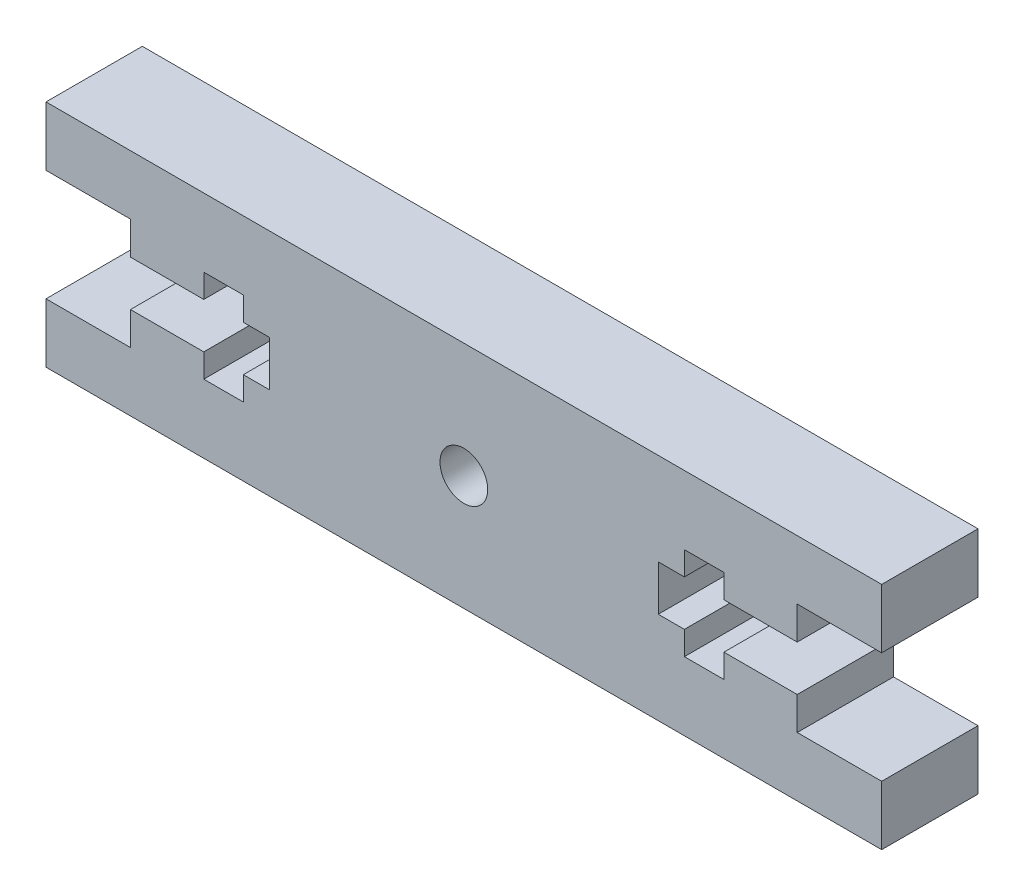
from build123d import *

# Parameters (mm, degrees)
SKETCH1_R           = 1.45
BOSS_EXTRUDE2_DEPTH = 5.85


with BuildPart() as part:
    # Sketch1 → Boss-Extrude2 (new body)
    with BuildSketch(Plane.XY):
        Polygon((728.35629315, 352.662910852), (779.11653315, 352.662910852), (779.11653315, 349.062910852), (773.98641315, 349.062910852), (773.98641315, 347.062910852), (769.53337815, 347.062910852), (769.53337815, 348.500545484), (767.132707678, 348.500545484), (767.132707678, 347.062910852), (765.545433323, 347.062910852), (765.545433323, 344.306300382), (767.132707678, 344.306300382), (767.132707678, 342.86866575), (769.53337815, 342.86866575), (769.53337815, 344.306300382), (773.98641315, 344.306300382), (773.98641315, 342.306300382), (779.11653315, 342.306300382), (779.11653315, 338.706300382), (728.35629315, 338.706300382), (728.35629315, 342.306300382), (733.48641315, 342.306300382), (733.48641315, 344.306300382), (737.93944815, 344.306300382), (737.93944815, 342.86866575), (740.340118622, 342.86866575), (740.340118622, 344.306300382), (741.927392977, 344.306300382), (741.927392977, 347.062910852), (740.340118622, 347.062910852), (740.340118622, 348.500545484), (737.93944815, 348.500545484), (737.93944815, 347.062910852), (733.48641315, 347.062910852), (733.48641315, 349.062910852), (728.35629315, 349.062910852), align=None)
        with Locations((753.73641315, 345.684605617)):
            Circle(SKETCH1_R, mode=Mode.SUBTRACT)
    extrude(amount=BOSS_EXTRUDE2_DEPTH)


solid = part.part
